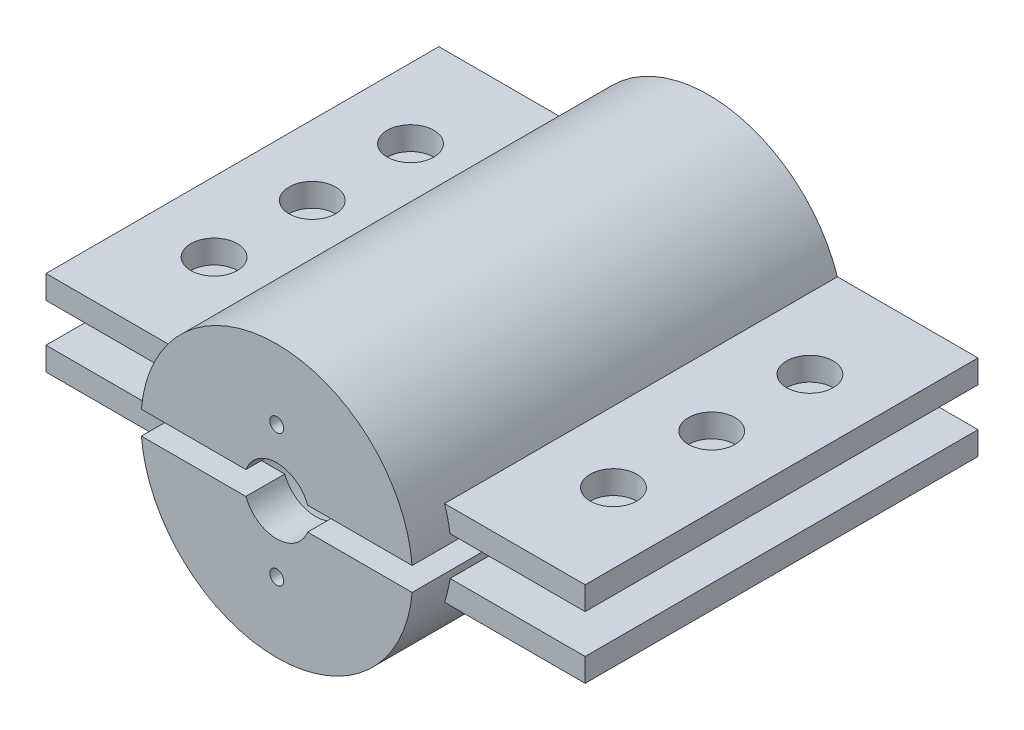
from build123d import *

# Parameters (mm, degrees)
ESBO_O1_R                  = 17.5
ESBO_O1_R_2                = 12.5
RESSALTO_EXTRUS_O1_DEPTH   = 55.6
RESSALTO_EXTRUS_O2_START   = -5
ESBO_O2_R                  = 12.5
RESSALTO_EXTRUS_O2_DEPTH   = 5
RESSALTO_EXTRUS_O3_START   = -34.8
ESBO_O4_R                  = 17.5
ESBO_O4_R_2                = 12.1
RESSALTO_EXTRUS_O3_DEPTH   = 34.8
CORTE_EXTRUS_O4_START      = -5
CORTE_EXTRUS_O4_DEPTH      = 5
ESBO_O13_R                 = 2
CORTE_EXTRUS_O6_DEPTH      = 78
ESBO_O14_W                 = 20
ESBO_O14_H                 = 3
RESSALTO_EXTRUS_O5_DEPTH   = 50.6
CORTE_EXTRUS_O7_DEPTH      = 50.6
CORTE_EXTRUS_O7_DEPTH_BACK = 50.6
ESBO_O15_R                 = 3
ESBO_O19_W                 = 3.249347661
ESBO_O19_H                 = 3
ESBO_O19_W_2               = 1.024720198
CORTE_EXTRUS_O8_DEPTH      = 78
ESBO_O24_W                 = 3
ESBO_O24_H                 = 3
CORTE_EXTRUS_O9_DEPTH      = 78
ESBO_O27_R                 = 4.25
CORTE_EXTRUS_O10_DEPTH     = 10
RESSALTO_EXTRUS_O6_START   = -5
ESBO_O28_R                 = 2
RESSALTO_EXTRUS_O6_DEPTH   = 5
ESBO_O29_R                 = 0.9
CORTE_EXTRUS_O11_DEPTH     = 5


with BuildPart() as part:
    # Esboço1 → Ressalto-extrusão1 (new body)
    with BuildSketch(Plane.XY):
        Circle(ESBO_O1_R)
        Circle(ESBO_O1_R_2, mode=Mode.SUBTRACT)
    extrude(amount=RESSALTO_EXTRUS_O1_DEPTH)

    # Esboço2 → Ressalto-extrusão2 (add)
    with BuildSketch(Plane.XY.offset(55.6).offset(RESSALTO_EXTRUS_O2_START)):
        Circle(ESBO_O2_R)
    extrude(amount=RESSALTO_EXTRUS_O2_DEPTH)

    # Esboço4 → Ressalto-extrusão3 (add)
    with BuildSketch(Plane.XY.offset(55.6).offset(RESSALTO_EXTRUS_O3_START)):
        Circle(ESBO_O4_R)
        Circle(ESBO_O4_R_2, mode=Mode.SUBTRACT)
    extrude(amount=RESSALTO_EXTRUS_O3_DEPTH)

    # Esboço12 → Corte-extrusão4 (cut)
    with BuildSketch(Plane.XY.offset(55.6).offset(CORTE_EXTRUS_O4_START)):
        with BuildLine():
            Line((0, 1.5), (17.435595774, 1.5))
            ThreePointArc((17.435595774, 1.5), (17.5, 0), (17.435595774, -1.5))
            Line((17.435595774, -1.5), (0, -1.5))
            Line((0, -1.5), (-17.435595774, -1.5))
            ThreePointArc((-17.435595774, -1.5), (-17.5, 0), (-17.435595774, 1.5))
            Line((-17.435595774, 1.5), (0, 1.5))
        make_face()
    extrude(amount=CORTE_EXTRUS_O4_DEPTH, mode=Mode.SUBTRACT)

    # Esboço13 → Corte-extrusão6 (cut)
    with BuildSketch(Plane.XY):
        with Locations((0, -7.714268488)):
            Circle(ESBO_O13_R)
    extrude(amount=CORTE_EXTRUS_O6_DEPTH, mode=Mode.SUBTRACT)

    # Esboço14 → Ressalto-extrusão5 (add)
    with BuildSketch(Plane(origin=(0, 0, 50.6), x_dir=(-1, 0, 0), z_dir=(0, 0, -1))):
        with Locations((24.721130295, -4)):
            Rectangle(ESBO_O14_W, ESBO_O14_H)
        with Locations((24.721130295, 4)):
            Rectangle(ESBO_O14_W, ESBO_O14_H)
        with Locations((-24.721130295, 4)):
            Rectangle(ESBO_O14_W, ESBO_O14_H)
        with Locations((-24.721130295, -4)):
            Rectangle(ESBO_O14_W, ESBO_O14_H)
    extrude(amount=RESSALTO_EXTRUS_O5_DEPTH)

    # Esboço15 → Corte-extrusão7 (cut, two sides: drawn at the far end of the back side and taken through both)
    with BuildSketch(Plane(origin=(0, 0, 0), x_dir=(1, 0, 0), z_dir=(0, 1, 0)).offset(-CORTE_EXTRUS_O7_DEPTH_BACK)):
        with Locations((-25.721130295, -25.3)):
            Circle(ESBO_O15_R)
        with Locations((25.721130295, -25.3)):
            Circle(ESBO_O15_R)
        with Locations((-25.721130295, -37.95)):
            Circle(ESBO_O15_R)
        with Locations((-25.721130295, -12.65)):
            Circle(ESBO_O15_R)
        with Locations((25.721130295, -12.65)):
            Circle(ESBO_O15_R)
        with Locations((25.721130295, -37.95)):
            Circle(ESBO_O15_R)
    extrude(amount=CORTE_EXTRUS_O7_DEPTH + CORTE_EXTRUS_O7_DEPTH_BACK, mode=Mode.SUBTRACT)

    # Esboço19 → Corte-extrusão8 (cut)
    with BuildSketch(Plane(origin=(0, 0, 50.6), x_dir=(-1, 0, 0), z_dir=(0, 0, -1))):
        with Locations((19.060269605, 0)):
            Rectangle(ESBO_O19_W, ESBO_O19_H)
        with Locations((-17.947955873, 0)):
            Rectangle(ESBO_O19_W_2, ESBO_O19_H)
    extrude(amount=CORTE_EXTRUS_O8_DEPTH, mode=Mode.SUBTRACT)

    # Esboço24 → Corte-extrusão9 (cut)
    with BuildSketch(Plane(origin=(0, 0, 0), x_dir=(-1, 0, 0), z_dir=(0, 0, -1))):
        with Locations((-15.935595774, 0)):
            Rectangle(ESBO_O24_W, ESBO_O24_H)
        with Locations((15.935595774, 0)):
            Rectangle(ESBO_O24_W, ESBO_O24_H)
    extrude(amount=-CORTE_EXTRUS_O9_DEPTH, mode=Mode.SUBTRACT)

    # Esboço27 → Corte-extrusão10 (cut)
    with BuildSketch(Plane.XY.offset(55.6)):
        Circle(ESBO_O27_R)
    extrude(amount=-CORTE_EXTRUS_O10_DEPTH, mode=Mode.SUBTRACT)

    # Esboço28 → Ressalto-extrusão6 (add)
    with BuildSketch(Plane.XY.offset(55.6).offset(RESSALTO_EXTRUS_O6_START)):
        with Locations((0, -7.714268488)):
            Circle(ESBO_O28_R)
    extrude(amount=RESSALTO_EXTRUS_O6_DEPTH)

    # Esboço29 → Corte-extrusão11 (cut)
    with BuildSketch(Plane.XY.offset(55.6)):
        with Locations((0, 8.5)):
            Circle(ESBO_O29_R)
        with Locations((0, -8.5)):
            Circle(ESBO_O29_R)
    extrude(amount=-CORTE_EXTRUS_O11_DEPTH, mode=Mode.SUBTRACT)


solid = part.part
